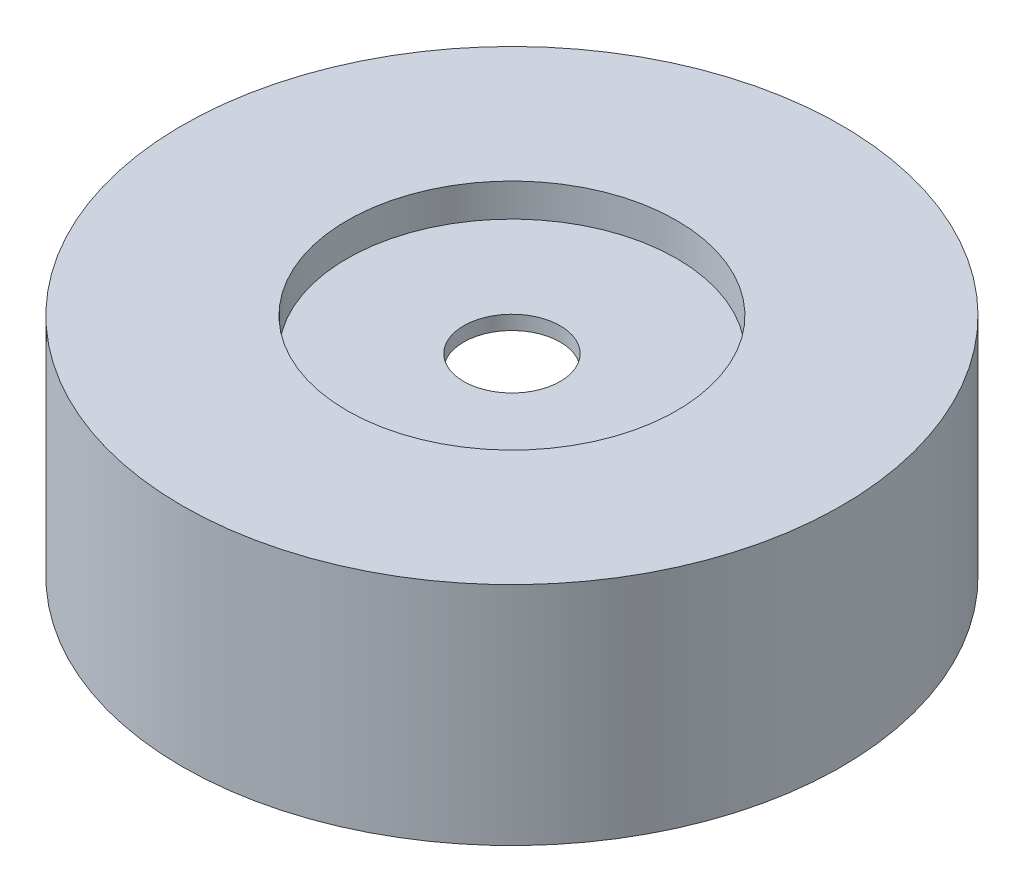
from build123d import *

# Parameters (mm, degrees)
SKETCH1_R           = 70
BOSS_EXTRUDE1_DEPTH = 48
SKETCH2_R           = 35
CUT_EXTRUDE1_DEPTH  = 7
SKETCH3_R           = 10.25
CUT_EXTRUDE2_DEPTH  = 108.14942837
SKETCH4_R           = 65
CUT_EXTRUDE4_DEPTH  = 38
BOSS_EXTRUDE2_DEPTH = 38
CUT_EXTRUDE5_DEPTH  = 25
CIRPATTERN1_COUNT   = 4
BOSS_EXTRUDE3_DEPTH = 3


with BuildPart() as part:
    # Sketch1 → Boss-Extrude1 (new body)
    with BuildSketch(Plane(origin=(0, 0, 0), x_dir=(1, 0, 0), z_dir=(0, 1, 0))):
        with Locations(Location((0, 0, 0), (0, 0, 270))):
            Circle(SKETCH1_R)
    extrude(amount=BOSS_EXTRUDE1_DEPTH)

    # Sketch2 → Cut-Extrude1 (cut)
    with BuildSketch(Plane(origin=(0, 48, 0), x_dir=(1, 0, 0), z_dir=(0, 1, 0))):
        with Locations(Location((0, 0, 0), (0, 0, 270))):
            Circle(SKETCH2_R)
    extrude(amount=-CUT_EXTRUDE1_DEPTH, mode=Mode.SUBTRACT)

    # Sketch3 → Cut-Extrude2 (cut, through all)
    with BuildSketch(Plane(origin=(0, 41, 0), x_dir=(1, 0, 0), z_dir=(0, 1, 0))):
        with Locations(Location((0, 0, 0), (0, 0, 270))):
            Circle(SKETCH3_R)
    extrude(amount=-CUT_EXTRUDE2_DEPTH, mode=Mode.SUBTRACT)

    # Sketch4 → Cut-Extrude4 (cut)
    with BuildSketch(Plane.XZ):
        with Locations(Location((0, 0, 0), (0, 0, 270))):
            Circle(SKETCH4_R)
    extrude(amount=-CUT_EXTRUDE4_DEPTH, mode=Mode.SUBTRACT)

    # Sketch7 → Boss-Extrude2 (add)
    with BuildSketch(Plane.XZ.offset(-38)):
        Polygon((-57.5, 4.907477288), (-61.75, 2.453738644), (-61.75, -2.453738644), (-57.5, -4.907477288), (-53.25, -2.453738644), (-53.25, 2.453738644), align=None)
    boss_extrude2 = extrude(amount=BOSS_EXTRUDE2_DEPTH)

    # Sketch10 → Cut-Extrude5 (cut)
    with BuildSketch(Plane.XZ):
        Polygon((-57.5, 3.175426481), (-60.25, 1.58771324), (-60.25, -1.58771324), (-57.5, -3.175426481), (-54.75, -1.58771324), (-54.75, 1.58771324), align=None)
    cut_extrude5 = extrude(amount=-CUT_EXTRUDE5_DEPTH, mode=Mode.SUBTRACT)

    # CirPattern1: Boss-Extrude2, Cut-Extrude5 ×4 about axis
    cirpattern1_axis = Axis((0, 0, 0), (0, 1, 0))
    add([boss_extrude2.rotate(cirpattern1_axis, i * 360 / CIRPATTERN1_COUNT) for i in range(1, CIRPATTERN1_COUNT)])
    add([cut_extrude5.rotate(cirpattern1_axis, i * 360 / CIRPATTERN1_COUNT) for i in range(1, CIRPATTERN1_COUNT)], mode=Mode.SUBTRACT)

    # Sketch14 → Boss-Extrude3 (add)
    with BuildSketch(Plane.XZ.offset(-38)):
        Polygon((31.041266081, 38.890872965), (29.309215274, 41.890872965), (25.845113659, 41.890872965), (24.113062851, 38.890872965), (25.845113659, 35.890872965), (29.309215274, 35.890872965), align=None)
        Polygon((25.26776339, 38.890872965), (26.422463928, 36.890872965), (28.731865005, 36.890872965), (29.886565543, 38.890872965), (28.731865005, 40.890872965), (26.422463928, 40.890872965), align=None, mode=Mode.SUBTRACT)
    boss_extrude3 = extrude(amount=BOSS_EXTRUDE3_DEPTH)

    # Mirror1: Boss-Extrude3 across plane
    add(boss_extrude3.mirror(Plane(origin=(0, 0, 0), x_dir=(0.7071067811865436, 0, 0.7071067811865515), z_dir=(-0.7071067811865515, 0, 0.7071067811865436))))


solid = part.part
